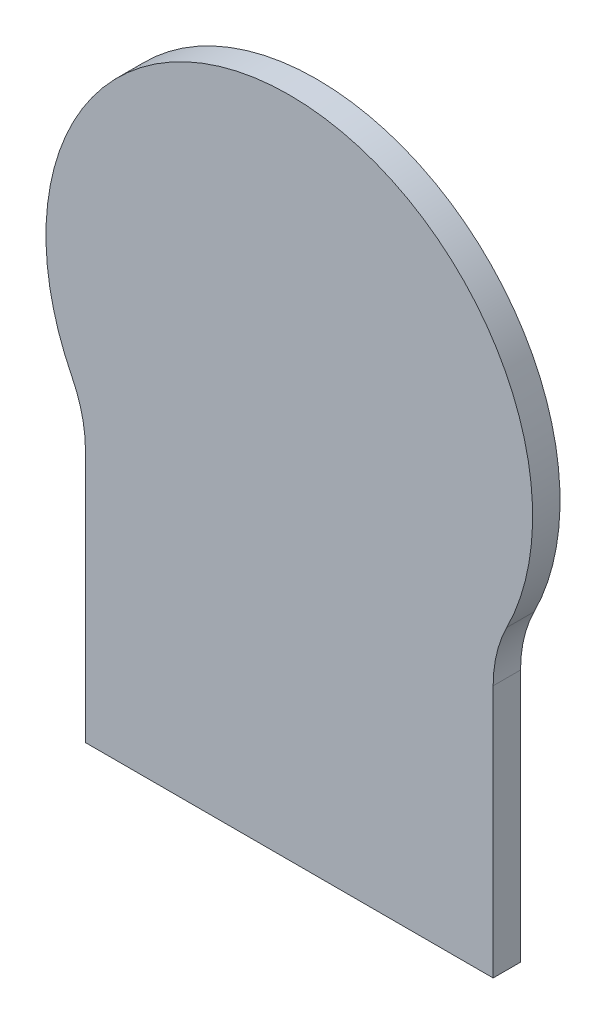
from build123d import *

# Parameters (mm, degrees)
SKETCH1_R           = 3.82
BOSS_EXTRUDE1_DEPTH = 0.43
FILLET1_R           = 2


with BuildPart() as part:
    # Sketch1 → Boss-Extrude1 (new body)
    with BuildSketch(Plane.XY):
        Circle(SKETCH1_R)
        with BuildLine():
            Line((-3.2, -2.086240638), (-3.2, -6.586240638))
            Line((-3.2, -6.586240638), (3.2, -6.586240638))
            Line((3.2, -6.586240638), (3.2, -2.086240638))
            ThreePointArc((3.2, -2.086240638), (0, -3.82), (-3.2, -2.086240638))
        make_face()
    extrude(amount=BOSS_EXTRUDE1_DEPTH)

    # Fillet1
    fillet1_edges = [part.edges().sort_by_distance(p)[0] for p in [
        (3.2, -2.086240638, 0.215),
        (-3.2, -2.086240638, 0.215),
    ]]
    fillet(fillet1_edges, radius=FILLET1_R)


solid = part.part
